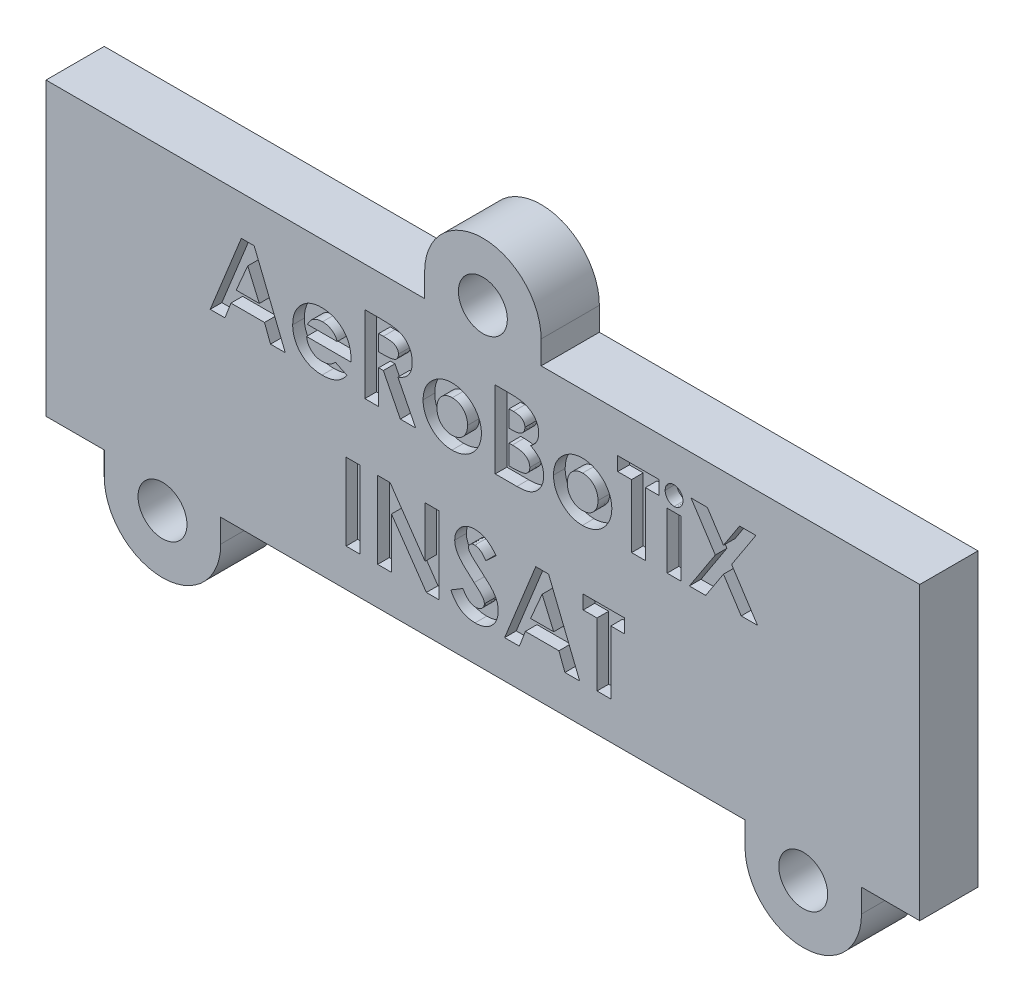
from build123d import *

# Parameters (mm, degrees)
ESQUISSE1_W             = 75
ESQUISSE1_H             = 25
BOSS_EXTRU_1_DEPTH      = 5
BOSS_EXTRU_2_DEPTH      = 5
ESQUISSE3_W             = 1.187232906
ESQUISSE3_H             = 4.833733974
ESQUISSE3_H_2           = 6.614583333
ENL_V_MAT_EXTRU_1_DEPTH = 1
ESQUISSE4_R             = 2.1
ENL_V_MAT_EXTRU_2_DEPTH = 43.561720024


with BuildPart() as part:
    # Esquisse1 → Boss.-Extru.1 (new body)
    with BuildSketch(Plane.XY):
        Rectangle(ESQUISSE1_W, ESQUISSE1_H)
    extrude(amount=BOSS_EXTRU_1_DEPTH)

    # Esquisse2 → Boss.-Extru.2 (add)
    with BuildSketch(Plane.XY.offset(5)):
        with BuildLine():
            Line((5, 12.5), (-5, 12.5))
            Line((-5, 12.5), (-5, 14.5))
            ThreePointArc((-5, 14.5), (0, 19.5), (5, 14.5))
            Line((5, 14.5), (5, 12.5))
        make_face()
        with BuildLine():
            Line((-22.5, -12.5), (-32.5, -12.5))
            Line((-32.5, -12.5), (-32.5, -14.5))
            ThreePointArc((-32.5, -14.5), (-27.5, -19.5), (-22.5, -14.5))
            Line((-22.5, -14.5), (-22.5, -12.5))
        make_face()
        with BuildLine():
            Line((22.5, -14.5), (22.5, -12.5))
            Line((22.5, -12.5), (32.5, -12.5))
            Line((32.5, -12.5), (32.5, -14.5))
            ThreePointArc((32.5, -14.5), (27.5, -19.5), (22.5, -14.5))
        make_face()
    extrude(amount=-BOSS_EXTRU_2_DEPTH)

    # Esquisse3 → Enlèv. mat.-Extru.1 (cut)
    # profile 1 of 15: a face of its own
    with BuildSketch(Plane.XY.offset(5)):
        Polygon((-20.732849643, 9.114583333), (-19.631744124, 9.114583333), (-16.960470085, 2.5), (-18.228530232, 2.5), (-18.742644481, 3.856837607), (-21.624599359, 3.856837607), (-22.138713608, 2.5), (-23.405448718, 2.5), align=None)
        Polygon((-20.182959402, 7.340359158), (-21.174086872, 5.044070513), (-19.191831931, 5.044070513), align=None, mode=Mode.SUBTRACT)
    # profile 2 of 15: a face of its own
    with BuildSketch(Plane.XY.offset(5)):
        with BuildLine():
            Line((-11.325088892, 4.620058761), (-15.137219551, 4.620058761))
            add(Edge.make_bspline(
                [(-15.137219551, 4.620058761), (-15.129446925, 4.575763965), (-15.1141731, 4.488721197), (-15.081005447, 4.362284024), (-15.038678548, 4.243131766), (-14.987952424, 4.131105145), (-14.929682319, 4.025611923), (-14.861715069, 3.927146901), (-14.784912776, 3.835797052), (-14.699719491, 3.751959392), (-14.607555232, 3.676839031), (-14.508866961, 3.611028846), (-14.403552838, 3.557068521), (-14.292820249, 3.511585565), (-14.175841767, 3.475558457), (-14.052445231, 3.450711246), (-13.922957744, 3.436033907), (-13.834746912, 3.433910998), (-13.789657202, 3.432825855)],
                knots=[0, 0, 0, 0, 1.091296461, 2.144483647, 3.168565212, 4.157007626, 5.126487748, 6.090021542, 7.05641414, 8.019231907, 8.98705074, 9.938580405, 10.892824166, 11.854447369, 12.841318655, 13.858982407, 14.905600794, 16, 16, 16, 16], degree=3))
            add(Edge.make_bspline(
                [(-13.789657202, 3.432825855), (-13.73523086, 3.434262763), (-13.628049364, 3.437092458), (-13.471027676, 3.46218765), (-13.31916483, 3.500092834), (-13.173897984, 3.556461025), (-13.03354445, 3.626629514), (-12.900414879, 3.714050818), (-12.772204901, 3.816170199), (-12.693981706, 3.89488378), (-12.654100728, 3.935014774)],
                knots=[0, 0, 0, 0, 1.021034703, 2.010718019, 2.977989445, 3.954245119, 4.929443971, 5.918328161, 6.938689359, 8, 8, 8, 8], degree=3))
            Line((-12.654100728, 3.935014774), (-11.660323184, 3.461976663))
            add(Edge.make_bspline(
                [(-11.660323184, 3.461976663), (-11.69161169, 3.418740749), (-11.753608714, 3.333070377), (-11.854816775, 3.212510038), (-11.960433831, 3.10002235), (-12.070538651, 2.996347163), (-12.185270877, 2.90177991), (-12.304311349, 2.815168591), (-12.429399797, 2.738838684), (-12.558035099, 2.669097396), (-12.692876385, 2.609308513), (-12.833550489, 2.558322664), (-12.979461579, 2.51223189), (-13.132452195, 2.477113245), (-13.291248386, 2.449313613), (-13.456230024, 2.429572191), (-13.627375365, 2.41737886), (-13.743701856, 2.415933356), (-13.802907569, 2.41519765)],
                knots=[0, 0, 0, 0, 1.028154879, 2.037251081, 3.030720504, 4.000128189, 4.949298328, 5.894184978, 6.834267904, 7.770992897, 8.712077017, 9.673380525, 10.653304757, 11.658697181, 12.695551717, 13.758623199, 14.859225354, 16, 16, 16, 16], degree=3))
            add(Edge.make_bspline(
                [(-13.802907569, 2.41519765), (-13.893994586, 2.41705464), (-14.07238326, 2.420691448), (-14.333308943, 2.454446235), (-14.581115971, 2.510415309), (-14.816504065, 2.58649667), (-15.038455722, 2.6869479), (-15.247080784, 2.809808088), (-15.444463716, 2.952721758), (-15.624573366, 3.118688286), (-15.788658571, 3.299332985), (-15.932780813, 3.493333057), (-16.053380253, 3.699333095), (-16.152418938, 3.915969749), (-16.229395245, 4.143797524), (-16.284890698, 4.382915838), (-16.318910075, 4.633210485), (-16.322584336, 4.80368908), (-16.324452457, 4.890366253)],
                knots=[0, 0, 0, 0, 1.103565453, 2.161269334, 3.182010356, 4.179077853, 5.15417608, 6.128274628, 7.109042802, 8.101804412, 9.090965879, 10.063106201, 11.02526161, 11.978650795, 12.945248442, 13.93468508, 14.949922959, 16, 16, 16, 16], degree=3))
            add(Edge.make_bspline(
                [(-16.324452457, 4.890366253), (-16.32256595, 4.979246004), (-16.318854332, 5.154112922), (-16.285183604, 5.410186987), (-16.229241819, 5.654516281), (-16.15204034, 5.88743727), (-16.054504084, 6.109678432), (-15.932370223, 6.319295423), (-15.788730091, 6.517018015), (-15.625236, 6.701921242), (-15.44436335, 6.868816605), (-15.25216907, 7.017553727), (-15.046493662, 7.141491369), (-14.829663491, 7.241632907), (-14.603065482, 7.322995379), (-14.364080477, 7.377135309), (-14.114526789, 7.413487031), (-13.943937383, 7.416834798), (-13.857234075, 7.418536325)],
                knots=[0, 0, 0, 0, 1.079208495, 2.12329425, 3.130605359, 4.119693003, 5.099659317, 6.073216462, 7.060498243, 8.06384408, 9.066070512, 10.045757761, 11.010926815, 11.975797609, 12.942977511, 13.929384301, 14.947594487, 16, 16, 16, 16], degree=3))
            add(Edge.make_bspline(
                [(-13.857234075, 7.418536325), (-13.765710689, 7.416650525), (-13.586013952, 7.412947951), (-13.323271003, 7.379467245), (-13.073818566, 7.323156878), (-12.836593834, 7.247733379), (-12.614626266, 7.144744645), (-12.403038559, 7.024907851), (-12.206905788, 6.878904995), (-12.024137386, 6.713750653), (-11.85915155, 6.530517634), (-11.714935649, 6.331470456), (-11.592225667, 6.118551701), (-11.492768008, 5.890897939), (-11.415870742, 5.649192609), (-11.360323918, 5.393749613), (-11.326564028, 5.123597367), (-11.322958136, 4.938608642), (-11.321113782, 4.843989967)],
                knots=[0, 0, 0, 0, 1.080001299, 2.120471247, 3.119684163, 4.095710327, 5.052285597, 6.002875087, 6.961153713, 7.931888285, 8.906493152, 9.865905668, 10.82813294, 11.801621613, 12.7925306, 13.817193356, 14.883530496, 16, 16, 16, 16], degree=3))
            Line((-11.321113782, 4.843989967), (-11.325088892, 4.620058761))
        make_face()
        with BuildLine():
            add(Edge.make_bspline(
                [(-12.508346688, 5.552884615), (-12.530750499, 5.613343426), (-12.575295112, 5.733551291), (-12.675919538, 5.899408814), (-12.809444931, 6.043048165), (-12.964744544, 6.170213222), (-13.142184075, 6.273428325), (-13.336172094, 6.348159412), (-13.544256631, 6.392969109), (-13.687407579, 6.398224499), (-13.760506394, 6.40090812)],
                knots=[0, 0, 0, 0, 0.954238005, 1.897273737, 2.851915805, 3.847685534, 4.862635127, 5.880135777, 6.917509367, 8, 8, 8, 8], degree=3))
            add(Edge.make_bspline(
                [(-13.760506394, 6.40090812), (-13.8403422, 6.398330176), (-13.996404578, 6.393290832), (-14.221513934, 6.33969556), (-14.433853956, 6.259706217), (-14.559037598, 6.177235507), (-14.621780265, 6.135900775)],
                knots=[0, 0, 0, 0, 1.044195649, 2.041185066, 3.018232172, 4, 4, 4, 4], degree=3))
            add(Edge.make_bspline(
                [(-14.621780265, 6.135900775), (-14.660927003, 6.104419337), (-14.744385848, 6.037302522), (-14.852774089, 5.903410848), (-14.959537409, 5.741298088), (-15.020238242, 5.618161994), (-15.052417201, 5.552884615)],
                knots=[0, 0, 0, 0, 0.82159062, 1.751589201, 2.808063854, 4, 4, 4, 4], degree=3))
            Line((-15.052417201, 5.552884615), (-12.508346688, 5.552884615))
        make_face(mode=Mode.SUBTRACT)
    # profile 3 of 15: a face of its own
    with BuildSketch(Plane.XY.offset(5)):
        with BuildLine():
            Line((-10.133880876, 9.114583333), (-8.750542535, 9.114583333))
            add(Edge.make_bspline(
                [(-8.750542535, 9.114583333), (-8.659104291, 9.11425878), (-8.483242793, 9.113634573), (-8.229660117, 9.103786233), (-7.996709556, 9.090081461), (-7.784046206, 9.069167615), (-7.591761047, 9.041438383), (-7.419661364, 9.008750207), (-7.267752188, 8.971495022), (-7.134752375, 8.925072122), (-7.014726621, 8.872707795), (-6.902845931, 8.812540223), (-6.796642051, 8.745239391), (-6.69682484, 8.669034432), (-6.602526862, 8.585296255), (-6.513570218, 8.493940568), (-6.431211949, 8.394192714), (-6.35596202, 8.286682971), (-6.287377767, 8.173585187), (-6.226763671, 8.054744078), (-6.177472189, 7.930076997), (-6.133917879, 7.801385654), (-6.102547122, 7.666830381), (-6.080729218, 7.527721095), (-6.064755003, 7.383568117), (-6.063836562, 7.285636985), (-6.063368056, 7.235681257)],
                knots=[0, 0, 0, 0, 1.749336639, 3.364467119, 4.854658419, 6.213483162, 7.451590619, 8.570285859, 9.5643256, 10.440900261, 11.26203566, 12.067320669, 12.869050712, 13.665104639, 14.467235401, 15.27997916, 16.102287765, 16.939272006, 17.78853747, 18.631303466, 19.488103222, 20.351255419, 21.228522269, 22.127379805, 23.044756219, 24, 24, 24, 24], degree=3))
            add(Edge.make_bspline(
                [(-6.063368056, 7.235681257), (-6.064585067, 7.183538952), (-6.066971406, 7.081297397), (-6.079825523, 6.931112892), (-6.103318811, 6.787426862), (-6.138902813, 6.650660002), (-6.179802002, 6.51911009), (-6.234187433, 6.395204304), (-6.295566766, 6.277140614), (-6.368465207, 6.166589074), (-6.448467684, 6.061094116), (-6.541508882, 5.964697641), (-6.641561161, 5.872218705), (-6.754248823, 5.789449874), (-6.874604491, 5.710794619), (-7.005019507, 5.639512011), (-7.144642737, 5.57381017), (-7.242804782, 5.537170284), (-7.293002137, 5.518433661)],
                knots=[0, 0, 0, 0, 1.099860209, 2.156625411, 3.176576793, 4.16617041, 5.135385252, 6.078461593, 7.016046972, 7.938469504, 8.868247731, 9.803980173, 10.76021508, 11.73834243, 12.748633912, 13.790971185, 14.870363756, 16, 16, 16, 16], degree=3))
            Line((-7.293002137, 5.518433661), (-5.766559829, 2.5))
            Line((-5.766559829, 2.5), (-7.086296408, 2.5))
            Line((-7.086296408, 2.5), (-8.543836806, 5.383279915))
            Line((-8.543836806, 5.383279915), (-8.94664797, 5.383279915))
            Line((-8.94664797, 5.383279915), (-8.94664797, 2.5))
            Line((-8.94664797, 2.5), (-10.133880876, 2.5))
            Line((-10.133880876, 2.5), (-10.133880876, 9.114583333))
        make_face()
        with BuildLine():
            Line((-8.94664797, 6.570512821), (-8.484210153, 6.570512821))
            add(Edge.make_bspline(
                [(-8.484210153, 6.570512821), (-8.427673286, 6.571149577), (-8.319417333, 6.572368828), (-8.163731055, 6.578024221), (-8.022330786, 6.591650923), (-7.894609304, 6.608867752), (-7.779923927, 6.628747068), (-7.679297609, 6.657235334), (-7.59117985, 6.687761233), (-7.516614851, 6.725697006), (-7.452908228, 6.768838208), (-7.397901638, 6.817847686), (-7.3524033, 6.874569916), (-7.314955847, 6.937463433), (-7.2858258, 7.007084514), (-7.264563098, 7.082668879), (-7.252680392, 7.165077528), (-7.251313246, 7.221950718), (-7.250600962, 7.251581697)],
                knots=[0, 0, 0, 0, 1.688639943, 3.233382647, 4.650958383, 5.928841754, 7.082724185, 8.122798841, 9.049171256, 9.863274652, 10.613301712, 11.341792392, 12.054588806, 12.776240173, 13.521029143, 14.301969904, 15.115324896, 16, 16, 16, 16], degree=3))
            add(Edge.make_bspline(
                [(-7.250600962, 7.251581697), (-7.2519476, 7.286637309), (-7.254592822, 7.355497562), (-7.280841638, 7.454632182), (-7.322624084, 7.546388055), (-7.379896373, 7.630350605), (-7.452023375, 7.703957973), (-7.5347948, 7.768843454), (-7.629997057, 7.820150037), (-7.718147182, 7.853991313), (-7.798343191, 7.874238898), (-7.87071756, 7.889327219), (-7.954527514, 7.900020745), (-8.049836327, 7.911363133), (-8.156401052, 7.918718098), (-8.274802531, 7.924085756), (-8.404700715, 7.926281928), (-8.495252087, 7.926984006), (-8.542511769, 7.927350427)],
                knots=[0, 0, 0, 0, 1.020303359, 2.004196876, 2.966617323, 3.9489082, 4.950758222, 5.960522915, 7.003732012, 8.091992268, 8.70421221, 9.413913587, 10.24622431, 11.166358409, 12.212345909, 13.359657661, 14.621978493, 16, 16, 16, 16], degree=3))
            Line((-8.542511769, 7.927350427), (-8.94664797, 7.927350427))
            Line((-8.94664797, 7.927350427), (-8.94664797, 6.570512821))
        make_face(mode=Mode.SUBTRACT)
    # profile 4 of 15: a face of its own
    with BuildSketch(Plane.XY.offset(5)):
        with BuildLine():
            add(Edge.make_bspline(
                [(-2.658023671, 7.418536325), (-2.601893591, 7.417537452), (-2.4907306, 7.41555923), (-2.32516721, 7.399092343), (-2.162498251, 7.372225937), (-2.001788722, 7.337438631), (-1.844530961, 7.288696412), (-1.68990017, 7.230237657), (-1.536513755, 7.16312017), (-1.388178735, 7.083226885), (-1.2438235, 6.99657533), (-1.106966146, 6.900991556), (-0.978743179, 6.79722634), (-0.856774344, 6.68768556), (-0.746743587, 6.567600168), (-0.64161935, 6.442756383), (-0.547081241, 6.308681486), (-0.459552571, 6.168642573), (-0.381626425, 6.023449462), (-0.313961898, 5.874112167), (-0.255235451, 5.722695383), (-0.20925382, 5.567354749), (-0.171185267, 5.410138638), (-0.147161305, 5.249120484), (-0.130081934, 5.085954348), (-0.128166795, 4.976097478), (-0.127203526, 4.920842097)],
                knots=[0, 0, 0, 0, 1.022364134, 2.024744242, 3.027414945, 4.024939316, 5.017584196, 6.023349371, 7.035562955, 8.064994934, 9.090267829, 10.101425541, 11.102933353, 12.093946398, 13.084502048, 14.067315274, 15.065326281, 16.070028806, 17.074376865, 18.064572984, 19.055292013, 20.030201733, 21.013838017, 21.999348303, 22.993720005, 24, 24, 24, 24], degree=3))
            add(Edge.make_bspline(
                [(-0.127203526, 4.920842097), (-0.128220097, 4.865155034), (-0.13024127, 4.754436529), (-0.146543394, 4.589735614), (-0.173512636, 4.427960266), (-0.208433458, 4.268157441), (-0.256993269, 4.112371966), (-0.313730226, 3.958307505), (-0.383377073, 3.808064011), (-0.460376793, 3.660002471), (-0.548468237, 3.518479884), (-0.642924512, 3.383061881), (-0.747608436, 3.257301111), (-0.856758367, 3.137297383), (-0.975551533, 3.027108687), (-1.102091772, 2.924945851), (-1.235283598, 2.82955989), (-1.376084801, 2.743188738), (-1.522691952, 2.667297487), (-1.672632549, 2.59887533), (-1.826783361, 2.541909), (-1.984825366, 2.495454526), (-2.146854409, 2.459485989), (-2.312512774, 2.435052135), (-2.481443692, 2.418058671), (-2.595262693, 2.416157463), (-2.652723524, 2.41519765)],
                knots=[0, 0, 0, 0, 1.012026251, 2.012137606, 3.004615893, 3.992048833, 4.982446996, 5.968083444, 6.973977695, 7.990229942, 8.999482246, 10.001782172, 10.988562221, 11.971415814, 12.948383116, 13.930088534, 14.925840678, 15.924049238, 16.929462851, 17.924729459, 18.917889337, 19.913673841, 20.916777188, 21.931792057, 22.95587778, 24, 24, 24, 24], degree=3))
            add(Edge.make_bspline(
                [(-2.652723524, 2.41519765), (-2.736742977, 2.417663786), (-2.902346597, 2.422524579), (-3.146241577, 2.455819738), (-3.380544141, 2.513129436), (-3.605636083, 2.593017891), (-3.821809803, 2.69539197), (-4.02717871, 2.822095439), (-4.223785664, 2.970633869), (-4.408225285, 3.139751801), (-4.577196963, 3.325289487), (-4.724814054, 3.523349836), (-4.85015291, 3.730964256), (-4.953100763, 3.948369498), (-5.032555514, 4.175863684), (-5.0899354, 4.412766685), (-5.123271266, 4.659744401), (-5.128090948, 4.827548185), (-5.130542201, 4.912891877)],
                knots=[0, 0, 0, 0, 1.029999031, 2.030143771, 3.011211297, 3.982305373, 4.953580601, 5.938004764, 6.935448627, 7.970290061, 9.001484052, 10.007591832, 10.993831261, 11.969999897, 12.951306496, 13.942897864, 14.953773953, 16, 16, 16, 16], degree=3))
            add(Edge.make_bspline(
                [(-5.130542201, 4.912891877), (-5.128005466, 5.004020231), (-5.123019564, 5.183131187), (-5.083429308, 5.445532819), (-5.02020794, 5.696769945), (-4.929457649, 5.936139777), (-4.813532133, 6.164083799), (-4.672013351, 6.380121252), (-4.504201908, 6.584301072), (-4.375691945, 6.707796026), (-4.310344468, 6.770593366)],
                knots=[0, 0, 0, 0, 1.043912699, 2.05178951, 3.033892, 4.007821512, 4.978932272, 5.95884105, 6.962068106, 8, 8, 8, 8], degree=3))
            add(Edge.make_bspline(
                [(-4.310344468, 6.770593366), (-4.250381625, 6.822645297), (-4.132087349, 6.925332982), (-3.939898085, 7.055575475), (-3.743117965, 7.168065254), (-3.539388495, 7.260552775), (-3.32814173, 7.330286873), (-3.11046019, 7.381047057), (-2.886389138, 7.41222545), (-2.734532336, 7.41642201), (-2.658023671, 7.418536325)],
                knots=[0, 0, 0, 0, 1.048115528, 2.067714963, 3.060638214, 4.039924844, 5.017819947, 5.994373833, 6.98952318, 8, 8, 8, 8], degree=3))
        make_face()
        with BuildLine():
            add(Edge.make_bspline(
                [(-2.631522937, 6.316105769), (-2.677489337, 6.314577998), (-2.76797469, 6.311570565), (-2.901171508, 6.295430473), (-3.02715046, 6.262349968), (-3.148413725, 6.22028062), (-3.262816143, 6.164018793), (-3.373490788, 6.098179491), (-3.474682823, 6.015789707), (-3.571289253, 5.92541414), (-3.658986359, 5.825054499), (-3.73371262, 5.715712745), (-3.80048219, 5.601572065), (-3.851110169, 5.478453625), (-3.893009661, 5.349722611), (-3.921366735, 5.213299121), (-3.941101279, 5.070707079), (-3.942566289, 4.973030553), (-3.943309295, 4.923492171)],
                knots=[0, 0, 0, 0, 1.030650113, 2.02884584, 2.99876339, 3.944280128, 4.900564847, 5.851248946, 6.823638398, 7.81794922, 8.81432732, 9.802856497, 10.78262424, 11.771747962, 12.779760563, 13.812642396, 14.89064281, 16, 16, 16, 16], degree=3))
            add(Edge.make_bspline(
                [(-3.943309295, 4.923492171), (-3.942439877, 4.872206816), (-3.940740766, 4.771979439), (-3.923146122, 4.625633991), (-3.894131974, 4.48675313), (-3.852911962, 4.355551398), (-3.801070837, 4.231087046), (-3.737467788, 4.114058401), (-3.661431557, 4.005169112), (-3.575224926, 3.904553269), (-3.480832347, 3.813223154), (-3.377404338, 3.734847067), (-3.269272075, 3.66674865), (-3.153943603, 3.612055111), (-3.033056919, 3.56982726), (-2.906253158, 3.538736315), (-2.772865967, 3.52198602), (-2.681916983, 3.519100784), (-2.635498047, 3.517628205)],
                knots=[0, 0, 0, 0, 1.141730614, 2.231293227, 3.276944405, 4.297399982, 5.28939179, 6.275415646, 7.257752684, 8.24146775, 9.222424823, 10.176631434, 11.126518621, 12.063689483, 13.012557477, 13.974037417, 14.965980454, 16, 16, 16, 16], degree=3))
            add(Edge.make_bspline(
                [(-2.635498047, 3.517628205), (-2.589055895, 3.518934316), (-2.498002316, 3.521495053), (-2.364458487, 3.540670924), (-2.237007173, 3.570849966), (-2.115088021, 3.613441257), (-1.999686759, 3.669305482), (-1.890361622, 3.737729691), (-1.786150861, 3.817195919), (-1.690491524, 3.910249259), (-1.601941505, 4.011178887), (-1.524288435, 4.120642995), (-1.459398601, 4.23767167), (-1.406177318, 4.361528566), (-1.364876501, 4.492043443), (-1.336342688, 4.62970141), (-1.316597593, 4.774075852), (-1.315165716, 4.873071633), (-1.314436432, 4.923492171)],
                knots=[0, 0, 0, 0, 1.031504075, 2.022346795, 2.991027682, 3.937587355, 4.885570121, 5.833146507, 6.798790848, 7.791235734, 8.792807298, 9.778388351, 10.766749885, 11.760164525, 12.768777521, 13.802286646, 14.880660483, 16, 16, 16, 16], degree=3))
            add(Edge.make_bspline(
                [(-1.314436432, 4.923492171), (-1.31531691, 4.973895087), (-1.317044693, 5.072801958), (-1.334640591, 5.217371664), (-1.363370003, 5.354584682), (-1.405121662, 5.483855121), (-1.456654651, 5.606657753), (-1.520301661, 5.722363997), (-1.596712879, 5.83040397), (-1.683338585, 5.930241951), (-1.779146168, 6.020290496), (-1.880778417, 6.100591939), (-1.99055935, 6.167007401), (-2.10642941, 6.221757451), (-2.228696872, 6.263879798), (-2.35722447, 6.295146945), (-2.492406102, 6.311658889), (-2.584666012, 6.314607984), (-2.631522937, 6.316105769)],
                knots=[0, 0, 0, 0, 1.123894411, 2.205445421, 3.243160173, 4.246488011, 5.231014757, 6.210004299, 7.185865357, 8.177612767, 9.153374344, 10.115157457, 11.061423229, 12.009021698, 12.96873347, 13.94135618, 14.954456845, 16, 16, 16, 16], degree=3))
        make_face(mode=Mode.SUBTRACT)
    # profile 5 of 15: a face of its own
    with BuildSketch(Plane.XY.offset(5)):
        with BuildLine():
            Line((1.06002938, 2.5), (1.06002938, 9.114583333))
            Line((1.06002938, 9.114583333), (2.120058761, 9.114583333))
            add(Edge.make_bspline(
                [(2.120058761, 9.114583333), (2.194267445, 9.114591802), (2.337859843, 9.11460819), (2.545026199, 9.107333188), (2.737155499, 9.097922157), (2.913636312, 9.087393403), (3.074769021, 9.069250255), (3.220308598, 9.050129359), (3.350545832, 9.027070737), (3.431064436, 9.006386438), (3.468946147, 8.996655065)],
                knots=[0, 0, 0, 0, 1.311965854, 2.538629056, 3.664479157, 4.713267157, 5.663616078, 6.530575999, 7.308677837, 8, 8, 8, 8], degree=3))
            add(Edge.make_bspline(
                [(3.468946147, 8.996655065), (3.51868868, 8.982928789), (3.616299499, 8.955993429), (3.756109341, 8.901596307), (3.888738478, 8.841130048), (4.014024975, 8.772149356), (4.131199521, 8.69382144), (4.239816814, 8.605524667), (4.34221946, 8.510803265), (4.434771376, 8.407017375), (4.518423058, 8.297348357), (4.591101372, 8.181824947), (4.654249511, 8.062213574), (4.704784563, 7.937009008), (4.742861776, 7.80678785), (4.77071129, 7.672106164), (4.788761546, 7.532537785), (4.790467059, 7.437584854), (4.791332799, 7.389385517)],
                knots=[0, 0, 0, 0, 1.099996261, 2.158545794, 3.195537121, 4.207578794, 5.205712374, 6.197378256, 7.190519799, 8.17788031, 9.159561366, 10.129234751, 11.085776129, 12.040971148, 13.00380137, 13.975669004, 14.972423361, 16, 16, 16, 16], degree=3))
            add(Edge.make_bspline(
                [(4.791332799, 7.389385517), (4.789069146, 7.32746202), (4.784613422, 7.205573224), (4.756149955, 7.026540635), (4.702776519, 6.857329106), (4.632938677, 6.694820131), (4.537981045, 6.539619871), (4.417403218, 6.391802119), (4.273158162, 6.246815344), (4.162514241, 6.159905553), (4.104963775, 6.114700187)],
                knots=[0, 0, 0, 0, 0.986156485, 1.941127874, 2.875419072, 3.804401753, 4.751181392, 5.761612777, 6.835722519, 8, 8, 8, 8], degree=3))
            add(Edge.make_bspline(
                [(4.104963775, 6.114700187), (4.151599911, 6.090892844), (4.243040472, 6.044213231), (4.372859203, 5.967485882), (4.493057178, 5.885876615), (4.604173327, 5.801027442), (4.703876862, 5.709341483), (4.796284709, 5.616101809), (4.876837945, 5.515966174), (4.948871076, 5.412503604), (5.011481103, 5.304215947), (5.066007533, 5.191286079), (5.112064052, 5.073328204), (5.151065904, 4.950942635), (5.180153495, 4.823708421), (5.199119223, 4.691580058), (5.21364057, 4.555008172), (5.214770194, 4.461978813), (5.215344551, 4.414678068)],
                knots=[0, 0, 0, 0, 1.164658916, 2.283573913, 3.35186032, 4.395461096, 5.390182219, 6.362969632, 7.312859996, 8.245001507, 9.165155236, 10.092416118, 11.032087915, 11.979892451, 12.947605196, 13.931445124, 14.948243989, 16, 16, 16, 16], degree=3))
            add(Edge.make_bspline(
                [(5.215344551, 4.414678068), (5.211617358, 4.324336349), (5.204261756, 4.14604733), (5.150481185, 3.884278102), (5.057242765, 3.636097132), (4.932042792, 3.402490796), (4.777772337, 3.190221615), (4.600405554, 3.004275656), (4.401728119, 2.846876529), (4.218424172, 2.740644329), (4.059880692, 2.669352589), (3.928562091, 2.62527554), (3.787528696, 2.584442628), (3.634197116, 2.555768914), (3.471347042, 2.529523578), (3.297390675, 2.513319164), (3.112653138, 2.502337831), (2.985767412, 2.500795032), (2.920380943, 2.5)],
                knots=[0, 0, 0, 0, 1.284142165, 2.534249414, 3.780121997, 5.041676246, 6.291546858, 7.49970053, 8.684500223, 9.883330709, 10.50184324, 11.153274765, 11.851151195, 12.587658647, 13.369265475, 14.195992086, 15.070362669, 16, 16, 16, 16], degree=3))
            Line((2.920380943, 2.5), (1.06002938, 2.5))
        make_face()
        with BuildLine():
            Line((2.247262286, 7.927350427), (2.247262286, 6.48571047))
            Line((2.247262286, 6.48571047), (2.562621027, 6.48571047))
            add(Edge.make_bspline(
                [(2.562621027, 6.48571047), (2.605481113, 6.486084226), (2.688219916, 6.48680574), (2.80772734, 6.496098585), (2.918849944, 6.511952757), (3.021166266, 6.534073315), (3.115629417, 6.562163198), (3.201635941, 6.595961376), (3.278807681, 6.637198828), (3.368463396, 6.698623832), (3.463235951, 6.789013475), (3.546663165, 6.919600043), (3.595801237, 7.069774098), (3.601273893, 7.175688471), (3.604099893, 7.23038111)],
                knots=[0, 0, 0, 0, 1.065314748, 2.056525647, 2.977365736, 3.853934255, 4.656397591, 5.425096493, 6.14721249, 6.826394842, 8.123232004, 9.372140726, 10.643011755, 12, 12, 12, 12], degree=3))
            add(Edge.make_bspline(
                [(3.604099893, 7.23038111), (3.601838576, 7.281609853), (3.59746641, 7.38065857), (3.547990689, 7.519731789), (3.471145113, 7.642979125), (3.38041811, 7.727331847), (3.294981007, 7.784942269), (3.221824516, 7.822876279), (3.141529774, 7.856834417), (3.052542361, 7.882799636), (2.955370443, 7.902283023), (2.850486039, 7.916591237), (2.737708187, 7.926330017), (2.659812285, 7.927002995), (2.619597606, 7.927350427)],
                knots=[0, 0, 0, 0, 1.347982417, 2.606269829, 3.849316587, 5.153353503, 5.842674298, 6.568177932, 7.326619318, 8.142485038, 9.012069166, 9.942760135, 10.937925643, 12, 12, 12, 12], degree=3))
            Line((2.619597606, 7.927350427), (2.247262286, 7.927350427))
        make_face(mode=Mode.SUBTRACT)
        with BuildLine():
            Line((2.247262286, 5.383279915), (2.247262286, 3.687232906))
            Line((2.247262286, 3.687232906), (2.589121761, 3.687232906))
            add(Edge.make_bspline(
                [(2.589121761, 3.687232906), (2.656707815, 3.687619023), (2.786650437, 3.68836138), (2.972793012, 3.697330822), (3.142043148, 3.713496662), (3.293952397, 3.73367841), (3.428753436, 3.761021523), (3.545990605, 3.795784786), (3.64727166, 3.83403043), (3.731989315, 3.881268342), (3.801198787, 3.936241557), (3.863653078, 3.992425504), (3.914574415, 4.057238994), (3.954864328, 4.127899765), (3.989735176, 4.202652551), (4.010766809, 4.284416423), (4.026779556, 4.370768095), (4.027660781, 4.430495679), (4.028111645, 4.461054354)],
                knots=[0, 0, 0, 0, 1.753078804, 3.370512758, 4.83203934, 6.162291463, 7.344201807, 8.395507345, 9.331626367, 10.147333109, 10.898971645, 11.62040215, 12.321813352, 13.025280112, 13.727906689, 14.453419512, 15.208716525, 16, 16, 16, 16], degree=3))
            add(Edge.make_bspline(
                [(4.028111645, 4.461054354), (4.02711736, 4.495998679), (4.025180759, 4.564060824), (4.009364515, 4.663540913), (3.980621234, 4.756412176), (3.944417669, 4.845049458), (3.894038484, 4.926279234), (3.834164545, 5.00291256), (3.761821542, 5.072354394), (3.680467614, 5.138804837), (3.585576312, 5.196985801), (3.477103115, 5.247468092), (3.354458738, 5.289629043), (3.217263277, 5.323197619), (3.066118186, 5.351686806), (2.899920273, 5.368697996), (2.72005369, 5.381349965), (2.595331274, 5.38262198), (2.530820146, 5.383279915)],
                knots=[0, 0, 0, 0, 0.845221588, 1.646264278, 2.427170338, 3.19324141, 3.95557735, 4.731569926, 5.540061037, 6.376114724, 7.268642756, 8.224665384, 9.265483498, 10.400594375, 11.639216012, 12.983232105, 14.439614077, 16, 16, 16, 16], degree=3))
            Line((2.530820146, 5.383279915), (2.247262286, 5.383279915))
        make_face(mode=Mode.SUBTRACT)
    # profile 6 of 15: a face of its own
    with BuildSketch(Plane.XY.offset(5)):
        with BuildLine():
            add(Edge.make_bspline(
                [(8.535886585, 7.418536325), (8.592016665, 7.417537452), (8.703179657, 7.41555923), (8.868743046, 7.399092343), (9.031412006, 7.372225937), (9.192121535, 7.337438631), (9.349379296, 7.288696412), (9.504010086, 7.230237657), (9.657396501, 7.16312017), (9.805731522, 7.083226885), (9.950086757, 6.99657533), (10.086944111, 6.900991556), (10.215167078, 6.79722634), (10.337135912, 6.68768556), (10.44716667, 6.567600168), (10.552290906, 6.442756383), (10.646829015, 6.308681486), (10.734357686, 6.168642573), (10.812283832, 6.023449462), (10.879948358, 5.874112167), (10.938674805, 5.722695383), (10.984656437, 5.567354749), (11.022724989, 5.410138638), (11.046748951, 5.249120484), (11.063828323, 5.085954348), (11.065743462, 4.976097478), (11.066706731, 4.920842097)],
                knots=[0, 0, 0, 0, 1.022364134, 2.024744242, 3.027414945, 4.024939316, 5.017584196, 6.023349371, 7.035562955, 8.064994934, 9.090267829, 10.101425541, 11.102933353, 12.093946398, 13.084502048, 14.067315274, 15.065326281, 16.070028806, 17.074376865, 18.064572984, 19.055292013, 20.030201733, 21.013838017, 21.999348303, 22.993720005, 24, 24, 24, 24], degree=3))
            add(Edge.make_bspline(
                [(11.066706731, 4.920842097), (11.06569016, 4.865155034), (11.063668986, 4.754436529), (11.047366862, 4.589735614), (11.02039762, 4.427960266), (10.985476799, 4.268157441), (10.936916987, 4.112371966), (10.88018003, 3.958307505), (10.810533184, 3.808064011), (10.733533463, 3.660002471), (10.64544202, 3.518479884), (10.550985744, 3.383061881), (10.44630182, 3.257301111), (10.337151889, 3.137297383), (10.218358724, 3.027108687), (10.091818484, 2.924945851), (9.958626658, 2.82955989), (9.817825456, 2.743188738), (9.671218304, 2.667297487), (9.521277707, 2.59887533), (9.367126895, 2.541909), (9.209084891, 2.495454526), (9.047055847, 2.459485989), (8.881397483, 2.435052135), (8.712466564, 2.418058671), (8.598647563, 2.416157463), (8.541186732, 2.41519765)],
                knots=[0, 0, 0, 0, 1.012026251, 2.012137606, 3.004615893, 3.992048833, 4.982446996, 5.968083444, 6.973977695, 7.990229942, 8.999482246, 10.001782172, 10.988562221, 11.971415814, 12.948383116, 13.930088534, 14.925840678, 15.924049238, 16.929462851, 17.924729459, 18.917889337, 19.913673841, 20.916777188, 21.931792057, 22.95587778, 24, 24, 24, 24], degree=3))
            add(Edge.make_bspline(
                [(8.541186732, 2.41519765), (8.45716728, 2.417663786), (8.291563659, 2.422524579), (8.04766868, 2.455819738), (7.813366115, 2.513129436), (7.588274173, 2.593017891), (7.372100453, 2.69539197), (7.166731546, 2.822095439), (6.970124592, 2.970633869), (6.785684972, 3.139751801), (6.616713293, 3.325289487), (6.469096203, 3.523349836), (6.343757347, 3.730964256), (6.240809493, 3.948369498), (6.161354743, 4.175863684), (6.103974856, 4.412766685), (6.07063899, 4.659744401), (6.065819308, 4.827548185), (6.063368056, 4.912891877)],
                knots=[0, 0, 0, 0, 1.029999031, 2.030143771, 3.011211297, 3.982305373, 4.953580601, 5.938004764, 6.935448627, 7.970290061, 9.001484052, 10.007591832, 10.993831261, 11.969999897, 12.951306496, 13.942897864, 14.953773953, 16, 16, 16, 16], degree=3))
            add(Edge.make_bspline(
                [(6.063368056, 4.912891877), (6.065904791, 5.004020231), (6.070890693, 5.183131187), (6.110480949, 5.445532819), (6.173702316, 5.696769945), (6.264452608, 5.936139777), (6.380378123, 6.164083799), (6.521896905, 6.380121252), (6.689708349, 6.584301072), (6.818218311, 6.707796026), (6.883565789, 6.770593366)],
                knots=[0, 0, 0, 0, 1.043912699, 2.05178951, 3.033892, 4.007821512, 4.978932272, 5.95884105, 6.962068106, 8, 8, 8, 8], degree=3))
            add(Edge.make_bspline(
                [(6.883565789, 6.770593366), (6.943528631, 6.822645297), (7.061822907, 6.925332982), (7.254012171, 7.055575475), (7.450792291, 7.168065254), (7.654521761, 7.260552775), (7.865768526, 7.330286873), (8.083450066, 7.381047057), (8.307521118, 7.41222545), (8.459377921, 7.41642201), (8.535886585, 7.418536325)],
                knots=[0, 0, 0, 0, 1.048115528, 2.067714963, 3.060638214, 4.039924844, 5.017819947, 5.994373833, 6.98952318, 8, 8, 8, 8], degree=3))
        make_face()
        with BuildLine():
            add(Edge.make_bspline(
                [(8.56238732, 6.316105769), (8.51642092, 6.314577998), (8.425935566, 6.311570565), (8.292738749, 6.295430473), (8.166759796, 6.262349968), (8.045496531, 6.22028062), (7.931094114, 6.164018793), (7.820419468, 6.098179491), (7.719227434, 6.015789707), (7.622621003, 5.92541414), (7.534923898, 5.825054499), (7.460197636, 5.715712745), (7.393428067, 5.601572065), (7.342800088, 5.478453625), (7.300900595, 5.349722611), (7.272543521, 5.213299121), (7.252808978, 5.070707079), (7.251343967, 4.973030553), (7.250600962, 4.923492171)],
                knots=[0, 0, 0, 0, 1.030650113, 2.02884584, 2.99876339, 3.944280128, 4.900564847, 5.851248946, 6.823638398, 7.81794922, 8.81432732, 9.802856497, 10.78262424, 11.771747962, 12.779760563, 13.812642396, 14.89064281, 16, 16, 16, 16], degree=3))
            add(Edge.make_bspline(
                [(7.250600962, 4.923492171), (7.251470379, 4.872206816), (7.25316949, 4.771979439), (7.270764134, 4.625633991), (7.299778283, 4.48675313), (7.340998294, 4.355551398), (7.392839419, 4.231087046), (7.456442468, 4.114058401), (7.532478699, 4.005169112), (7.618685331, 3.904553269), (7.71307791, 3.813223154), (7.816505919, 3.734847067), (7.924638182, 3.66674865), (8.039966653, 3.612055111), (8.160853338, 3.56982726), (8.287657099, 3.538736315), (8.42104429, 3.52198602), (8.511993274, 3.519100784), (8.55841221, 3.517628205)],
                knots=[0, 0, 0, 0, 1.141730614, 2.231293227, 3.276944405, 4.297399982, 5.28939179, 6.275415646, 7.257752684, 8.24146775, 9.222424823, 10.176631434, 11.126518621, 12.063689483, 13.012557477, 13.974037417, 14.965980454, 16, 16, 16, 16], degree=3))
            add(Edge.make_bspline(
                [(8.55841221, 3.517628205), (8.604854362, 3.518934316), (8.695907941, 3.521495053), (8.82945177, 3.540670924), (8.956903084, 3.570849966), (9.078822236, 3.613441257), (9.194223497, 3.669305482), (9.303548635, 3.737729691), (9.407759395, 3.817195919), (9.503418732, 3.910249259), (9.591968751, 4.011178887), (9.669621821, 4.120642995), (9.734511655, 4.23767167), (9.787732938, 4.361528566), (9.829033755, 4.492043443), (9.857567569, 4.62970141), (9.877312663, 4.774075852), (9.878744541, 4.873071633), (9.879473825, 4.923492171)],
                knots=[0, 0, 0, 0, 1.031504075, 2.022346795, 2.991027682, 3.937587355, 4.885570121, 5.833146507, 6.798790848, 7.791235734, 8.792807298, 9.778388351, 10.766749885, 11.760164525, 12.768777521, 13.802286646, 14.880660483, 16, 16, 16, 16], degree=3))
            add(Edge.make_bspline(
                [(9.879473825, 4.923492171), (9.878593347, 4.973895087), (9.876865563, 5.072801958), (9.859269665, 5.217371664), (9.830540253, 5.354584682), (9.788788594, 5.483855121), (9.737255606, 5.606657753), (9.673608595, 5.722363997), (9.597197377, 5.83040397), (9.510571671, 5.930241951), (9.414764088, 6.020290496), (9.313131839, 6.100591939), (9.203350906, 6.167007401), (9.087480847, 6.221757451), (8.965213385, 6.263879798), (8.836685786, 6.295146945), (8.701504154, 6.311658889), (8.609244244, 6.314607984), (8.56238732, 6.316105769)],
                knots=[0, 0, 0, 0, 1.123894411, 2.205445421, 3.243160173, 4.246488011, 5.231014757, 6.210004299, 7.185865357, 8.177612767, 9.153374344, 10.115157457, 11.061423229, 12.009021698, 12.96873347, 13.94135618, 14.954456845, 16, 16, 16, 16], degree=3))
        make_face(mode=Mode.SUBTRACT)
    # profile 7 of 15: a face of its own
    with BuildSketch(Plane.XY.offset(5)):
        Polygon((11.575520833, 9.114583333), (15.137219551, 9.114583333), (15.137219551, 7.927350427), (13.949986645, 7.927350427), (13.949986645, 2.5), (12.762753739, 2.5), (12.762753739, 7.927350427), (11.575520833, 7.927350427), align=None)
    # profile 8 of 15: a face of its own
    with BuildSketch(Plane.XY.offset(5)):
        with BuildLine():
            add(Edge.make_bspline(
                [(16.406604734, 9.368990385), (16.457774464, 9.366479804), (16.558251159, 9.361550037), (16.702197697, 9.313495776), (16.834311446, 9.238076049), (16.951103663, 9.134598385), (17.048240509, 9.011027129), (17.122456667, 8.872680891), (17.163799396, 8.719397716), (17.16954129, 8.613511302), (17.172475962, 8.559392945)],
                knots=[0, 0, 0, 0, 0.989868614, 1.943702388, 2.910836514, 3.924849579, 4.949916355, 5.946401046, 6.950409252, 8, 8, 8, 8], degree=3))
            add(Edge.make_bspline(
                [(17.172475962, 8.559392945), (17.169646288, 8.505673411), (17.164132533, 8.400998341), (17.121505138, 8.249796056), (17.050267759, 8.111517014), (16.952344166, 7.98978102), (16.836818128, 7.887969925), (16.707591166, 7.811180998), (16.565024053, 7.765799985), (16.466106454, 7.760458117), (16.415879991, 7.757745726)],
                knots=[0, 0, 0, 0, 1.05296456, 2.051751585, 3.055639087, 4.085634717, 5.099016424, 6.062201612, 7.016062274, 8, 8, 8, 8], degree=3))
            add(Edge.make_bspline(
                [(16.415879991, 7.757745726), (16.364263592, 7.760247332), (16.262912754, 7.765159334), (16.117785558, 7.813326031), (15.98390975, 7.888151779), (15.867624176, 7.993743651), (15.769374896, 8.118192975), (15.69840053, 8.259760033), (15.654004308, 8.414091355), (15.648734515, 8.521546018), (15.646033654, 8.576618423)],
                knots=[0, 0, 0, 0, 0.989065327, 1.942068821, 2.907541208, 3.917690034, 4.939857478, 5.938239964, 6.943311734, 8, 8, 8, 8], degree=3))
            add(Edge.make_bspline(
                [(15.646033654, 8.576618423), (15.648972929, 8.629425767), (15.654746712, 8.733158172), (15.696337089, 8.883033413), (15.768851473, 9.019053834), (15.865288632, 9.140363003), (15.981055021, 9.241910418), (16.11308946, 9.315039599), (16.256067233, 9.361109083), (16.355907443, 9.366336158), (16.406604734, 9.368990385)],
                knots=[0, 0, 0, 0, 1.038616768, 2.040212704, 3.031499824, 4.052181184, 5.074969369, 6.039807101, 7.004644834, 8, 8, 8, 8], degree=3))
        make_face()
    # profile 9 of 15: a face of its own
    with BuildSketch(Plane.XY.offset(5)):
        with Locations((16.409254808, 4.916866987)):
            Rectangle(ESQUISSE3_W, ESQUISSE3_H)
    # profile 10 of 15: a face of its own
    with BuildSketch(Plane.XY.offset(5)):
        Polygon((17.870770316, 9.114583333), (19.270009098, 9.114583333), (20.652022403, 6.990549462), (22.036685781, 9.114583333), (23.437249599, 9.114583333), (21.351641794, 5.915944678), (23.575053419, 2.5), (22.175814637, 2.5), (20.652022403, 4.842664931), (19.124255058, 2.5), (17.723691239, 2.5), (19.952403011, 5.917269715), align=None)
    # profile 11 of 15: a face of its own
    with BuildSketch(Plane.XY.offset(5)):
        with Locations((-11.151509081, -5.962606838)):
            Rectangle(ESQUISSE3_W, ESQUISSE3_H_2)
    # profile 12 of 15: a face of its own
    with BuildSketch(Plane.XY.offset(5)):
        Polygon((-9.031450321, -2.655315171), (-7.962145683, -2.655315171), (-4.9609375, -7.008060814), (-4.9609375, -2.655315171), (-3.773704594, -2.655315171), (-3.773704594, -9.269898504), (-4.850959452, -9.269898504), (-7.844217415, -4.930403228), (-7.844217415, -9.269898504), (-9.031450321, -9.269898504), align=None)
    # profile 13 of 15: a face of its own
    with BuildSketch(Plane.XY.offset(5)):
        with BuildLine():
            Line((1.144831731, -3.539114667), (0.257057125, -4.351362179))
            add(Edge.make_bspline(
                [(0.257057125, -4.351362179), (0.219028667, -4.297719087), (0.146019332, -4.19473183), (0.027678815, -4.056829465), (-0.090127334, -3.939188485), (-0.208490517, -3.84230034), (-0.32845986, -3.766753698), (-0.449827115, -3.71326584), (-0.571904216, -3.679263101), (-0.653921183, -3.675028942), (-0.694319244, -3.672943376)],
                knots=[0, 0, 0, 0, 1.299362458, 2.494594718, 3.587462134, 4.587049575, 5.512617175, 6.380583204, 7.202344345, 8, 8, 8, 8], degree=3))
            add(Edge.make_bspline(
                [(-0.694319244, -3.672943376), (-0.732001396, -3.674264886), (-0.804755732, -3.676816376), (-0.908472435, -3.70217799), (-1.000553601, -3.745948412), (-1.080909363, -3.803181922), (-1.144562982, -3.872135031), (-1.19538546, -3.944449114), (-1.224002786, -4.024267507), (-1.227769389, -4.07909), (-1.229634081, -4.106230385)],
                knots=[0, 0, 0, 0, 1.185010067, 2.2879431, 3.333075148, 4.379039566, 5.372662701, 6.27520591, 7.14612461, 8, 8, 8, 8], degree=3))
            add(Edge.make_bspline(
                [(-1.229634081, -4.106230385), (-1.228465573, -4.133762147), (-1.226112361, -4.18920729), (-1.20338353, -4.270469053), (-1.169124692, -4.349871254), (-1.136388974, -4.398207152), (-1.119656033, -4.422914163)],
                knots=[0, 0, 0, 0, 0.967525499, 1.948461899, 2.951351359, 4, 4, 4, 4], degree=3))
            add(Edge.make_bspline(
                [(-1.119656033, -4.422914163), (-1.104443979, -4.442118664), (-1.069427841, -4.486324888), (-1.002659237, -4.556340658), (-0.918811893, -4.642116104), (-0.814659186, -4.74070166), (-0.694524782, -4.855642849), (-0.552840296, -4.982421289), (-0.393684026, -5.12496316), (-0.280559436, -5.224224158), (-0.221281133, -5.276237814)],
                knots=[0, 0, 0, 0, 0.473873513, 1.090794244, 1.870441696, 2.795289791, 3.865433203, 5.087734844, 6.473946851, 8, 8, 8, 8], degree=3))
            add(Edge.make_bspline(
                [(-0.221281133, -5.276237814), (-0.165639919, -5.324392478), (-0.060044454, -5.415780027), (0.090196924, -5.545489979), (0.222234072, -5.662186861), (0.337990472, -5.764119301), (0.435711367, -5.852356804), (0.515807579, -5.927321144), (0.579257346, -5.987552905), (0.615324823, -6.023932924), (0.630717481, -6.039458968)],
                knots=[0, 0, 0, 0, 1.543621617, 2.929473131, 4.163658386, 5.240097082, 6.164993805, 6.925417477, 7.541396219, 8, 8, 8, 8], degree=3))
            add(Edge.make_bspline(
                [(0.630717481, -6.039458968), (0.689114017, -6.102656526), (0.801372668, -6.224144428), (0.94726934, -6.412412469), (1.06734702, -6.596200466), (1.16024139, -6.778966688), (1.230398955, -6.963348087), (1.279860967, -7.153866608), (1.309484096, -7.352513049), (1.312772955, -7.488064996), (1.314436432, -7.556626018)],
                knots=[0, 0, 0, 0, 1.206664779, 2.319633467, 3.337109185, 4.282041471, 5.190008762, 6.099243693, 7.03861361, 8, 8, 8, 8], degree=3))
            add(Edge.make_bspline(
                [(1.314436432, -7.556626018), (1.313252411, -7.623430327), (1.31092932, -7.754502866), (1.2824759, -7.946308003), (1.241902994, -8.129873844), (1.179170163, -8.303202933), (1.10271176, -8.469140413), (1.00686011, -8.625101507), (0.89429549, -8.772664605), (0.765279152, -8.909191835), (0.622571761, -9.033080833), (0.469504523, -9.143369746), (0.304580667, -9.234427291), (0.129209278, -9.309406685), (-0.056515772, -9.367156817), (-0.252373229, -9.409839546), (-0.45866267, -9.435457048), (-0.599726362, -9.438135053), (-0.67179362, -9.439503205)],
                knots=[0, 0, 0, 0, 1.043214005, 2.046824704, 3.02475056, 3.976699089, 4.921714032, 5.875962561, 6.831408892, 7.817874052, 8.806269674, 9.781291748, 10.760897367, 11.74438705, 12.757449933, 13.795994037, 14.874007457, 16, 16, 16, 16], degree=3))
            add(Edge.make_bspline(
                [(-0.67179362, -9.439503205), (-0.728365803, -9.438499577), (-0.840411171, -9.436511817), (-1.005549104, -9.420283416), (-1.165008446, -9.394092503), (-1.31860958, -9.3565531), (-1.467044507, -9.308985585), (-1.610319322, -9.250883688), (-1.747444953, -9.181346851), (-1.879458956, -9.101805028), (-2.005719581, -9.009446494), (-2.127823344, -8.906159488), (-2.244557393, -8.790355412), (-2.35648238, -8.662308136), (-2.462882176, -8.521655062), (-2.567239629, -8.370355043), (-2.66491678, -8.205600158), (-2.725256301, -8.090023273), (-2.756076389, -8.030989166)],
                knots=[0, 0, 0, 0, 1.016823716, 2.013894106, 2.979844003, 3.91962641, 4.853723003, 5.779685073, 6.695824784, 7.614987388, 8.547259901, 9.504950863, 10.487499108, 11.500346958, 12.559593716, 13.656357062, 14.802919212, 16, 16, 16, 16], degree=3))
            Line((-2.756076389, -8.030989166), (-1.711947449, -7.404246795))
            add(Edge.make_bspline(
                [(-1.711947449, -7.404246795), (-1.673396126, -7.47125822), (-1.599489943, -7.599724848), (-1.474249008, -7.772336046), (-1.345946064, -7.920148965), (-1.211614861, -8.040551001), (-1.072888817, -8.135152085), (-0.929097854, -8.202760583), (-0.780140945, -8.244610167), (-0.678678265, -8.249720968), (-0.628067408, -8.252270299)],
                knots=[0, 0, 0, 0, 1.283663364, 2.460892379, 3.537111102, 4.529833553, 5.449777664, 6.316464042, 7.160231139, 8, 8, 8, 8], degree=3))
            add(Edge.make_bspline(
                [(-0.628067408, -8.252270299), (-0.57658892, -8.250188377), (-0.476713156, -8.246149144), (-0.334153283, -8.20883997), (-0.203448994, -8.15026183), (-0.090469172, -8.066678902), (0.005195018, -7.970211499), (0.075800681, -7.862887103), (0.120155635, -7.746764697), (0.124845029, -7.666098435), (0.127203526, -7.625527928)],
                knots=[0, 0, 0, 0, 1.13588714, 2.203786484, 3.234766741, 4.283437687, 5.291419208, 6.222934724, 7.106237994, 8, 8, 8, 8], degree=3))
            add(Edge.make_bspline(
                [(0.127203526, -7.625527928), (0.125025551, -7.587783673), (0.120601203, -7.511109832), (0.088012822, -7.39710816), (0.037067242, -7.283158334), (-0.023204971, -7.189693604), (-0.084539495, -7.111438119), (-0.143189134, -7.043633281), (-0.21460888, -6.968720805), (-0.298617643, -6.886606458), (-0.394105449, -6.796567366), (-0.501152734, -6.698612345), (-0.620985302, -6.593604263), (-0.705683197, -6.522073795), (-0.749970787, -6.484671307)],
                knots=[0, 0, 0, 0, 0.916159276, 1.861089862, 2.860218735, 3.940849679, 4.552606315, 5.27541173, 6.11797699, 7.06649574, 8.129236253, 9.306560635, 10.591630461, 12, 12, 12, 12], degree=3))
            add(Edge.make_bspline(
                [(-0.749970787, -6.484671307), (-0.834163256, -6.413436405), (-0.995754089, -6.276715065), (-1.224102437, -6.07478195), (-1.429864745, -5.886056951), (-1.611263828, -5.708207015), (-1.770610991, -5.544516617), (-1.906827066, -5.393656202), (-2.018415658, -5.254462088), (-2.135838589, -5.089595975), (-2.247413851, -4.888695287), (-2.34384654, -4.646988471), (-2.406407998, -4.405312323), (-2.413417139, -4.243064269), (-2.416866987, -4.163206964)],
                knots=[0, 0, 0, 0, 1.345494975, 2.582412109, 3.71882943, 4.751509156, 5.681369928, 6.505683931, 7.230279997, 7.856715994, 8.973648664, 10.023341002, 11.027102913, 12, 12, 12, 12], degree=3))
            add(Edge.make_bspline(
                [(-2.416866987, -4.163206964), (-2.4154322, -4.10657645), (-2.412605515, -3.995008255), (-2.38739105, -3.830963479), (-2.349707071, -3.672674053), (-2.294979114, -3.520717491), (-2.223948835, -3.375284123), (-2.13768532, -3.235661991), (-2.03484906, -3.103136148), (-1.918959538, -2.977794446), (-1.791278955, -2.863246395), (-1.654836027, -2.762146263), (-1.510403032, -2.67675562), (-1.358863538, -2.605917882), (-1.199278518, -2.551696094), (-1.032823627, -2.513260987), (-0.859260117, -2.490401012), (-0.741205964, -2.487293463), (-0.681068877, -2.48571047)],
                knots=[0, 0, 0, 0, 1.010766082, 1.991317756, 2.957454644, 3.913069143, 4.869106762, 5.843196583, 6.838735724, 7.860187025, 8.887984031, 9.89767229, 10.887916223, 11.879572884, 12.879850636, 13.892031539, 14.926195476, 16, 16, 16, 16], degree=3))
            add(Edge.make_bspline(
                [(-0.681068877, -2.48571047), (-0.603134188, -2.488561487), (-0.447879999, -2.494241016), (-0.218332204, -2.538653077), (0.005880486, -2.608495721), (0.186555273, -2.692753186), (0.330314829, -2.774373433), (0.440493099, -2.849519075), (0.55260542, -2.935602447), (0.667555907, -3.032894819), (0.783208603, -3.143229309), (0.902852066, -3.263979317), (1.024856009, -3.396188405), (1.104139227, -3.490637964), (1.144831731, -3.539114667)],
                knots=[0, 0, 0, 0, 1.282922637, 2.555718331, 3.837320111, 5.142675274, 5.830281639, 6.55870424, 7.337177975, 8.157850921, 9.037902056, 9.96903443, 10.957596896, 12, 12, 12, 12], degree=3))
        make_face()
    # profile 14 of 15: a face of its own
    with BuildSketch(Plane.XY.offset(5)):
        Polygon((4.538250785, -2.655315171), (5.639356303, -2.655315171), (8.310630342, -9.269898504), (7.042570196, -9.269898504), (6.528455946, -7.913060897), (3.646501068, -7.913060897), (3.132386819, -9.269898504), (1.865651709, -9.269898504), align=None)
        Polygon((5.088141026, -4.429539346), (4.097013555, -6.725827991), (6.079268496, -6.725827991), align=None, mode=Mode.SUBTRACT)
    # profile 15 of 15: a face of its own
    with BuildSketch(Plane.XY.offset(5)):
        Polygon((8.607438568, -2.655315171), (12.169137286, -2.655315171), (12.169137286, -3.842548077), (10.98190438, -3.842548077), (10.98190438, -9.269898504), (9.794671474, -9.269898504), (9.794671474, -3.842548077), (8.607438568, -3.842548077), align=None)
    extrude(amount=-ENL_V_MAT_EXTRU_1_DEPTH, mode=Mode.SUBTRACT)

    # Esquisse4 → Enlèv. mat.-Extru.2 (cut, through all)
    with BuildSketch(Plane.XY.offset(5)):
        with Locations((0, 14.5)):
            Circle(ESQUISSE4_R)
        with Locations((27.5, -14.5)):
            Circle(ESQUISSE4_R)
        with Locations((-27.5, -14.5)):
            Circle(ESQUISSE4_R)
    extrude(amount=-ENL_V_MAT_EXTRU_2_DEPTH, mode=Mode.SUBTRACT)


solid = part.part
